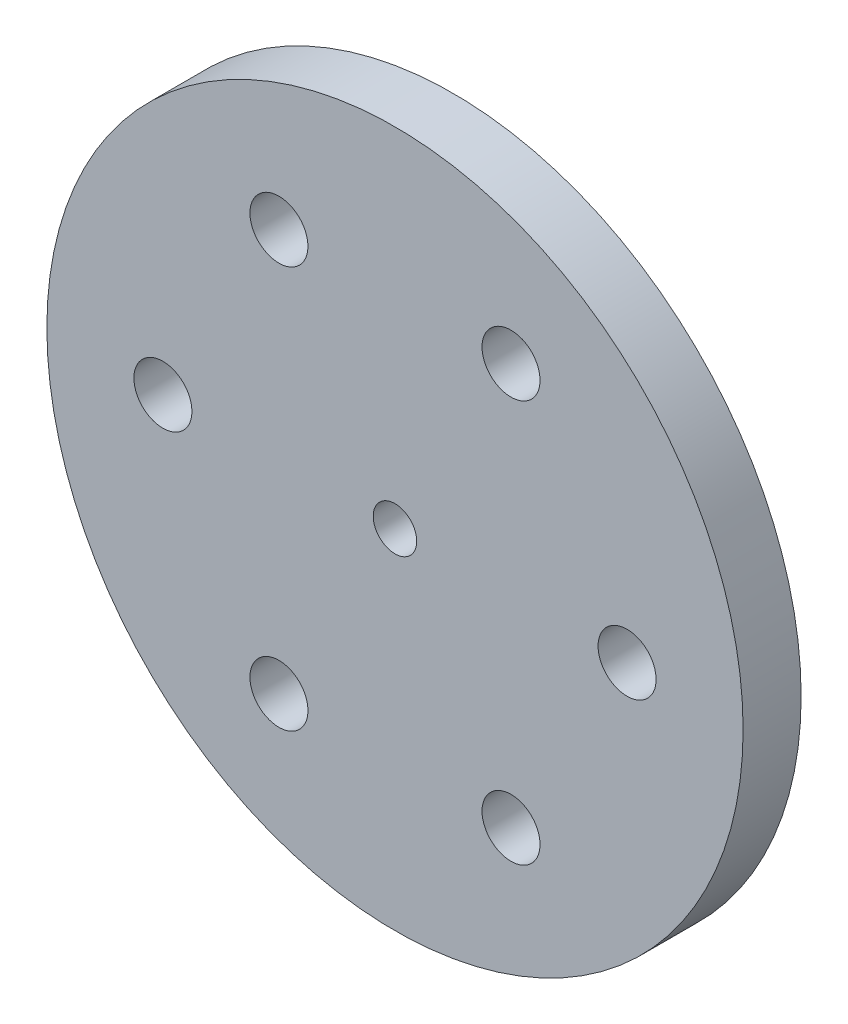
from build123d import *

# Parameters (mm, degrees)
SKETCH1_R           = 38.1
BOSS_EXTRUDE1_DEPTH = 6.35
SKETCH4_R           = 3.175
CUT_EXTRUDE2_DEPTH  = 55.254423783
SKETCH2_R           = 2.38125
CUT_EXTRUDE3_DEPTH  = 55.254423783


with BuildPart() as part:
    # Sketch1 → Boss-Extrude1 (new body)
    with BuildSketch(Plane.XY):
        Circle(SKETCH1_R)
    extrude(amount=BOSS_EXTRUDE1_DEPTH)

    # Sketch4 → Cut-Extrude2 (cut, through all)
    with BuildSketch(Plane(origin=(0, 0, 0), x_dir=(-1, 0, 0), z_dir=(0, 0, -1))):
        with Locations((-25.4, 0)):
            Circle(SKETCH4_R)
        with Locations((-12.7, 21.997045256)):
            Circle(SKETCH4_R)
        with Locations((12.7, 21.997045256)):
            Circle(SKETCH4_R)
        with Locations((25.4, 0)):
            Circle(SKETCH4_R)
        with Locations((12.7, -21.997045256)):
            Circle(SKETCH4_R)
        with Locations((-12.7, -21.997045256)):
            Circle(SKETCH4_R)
    extrude(amount=-CUT_EXTRUDE2_DEPTH, mode=Mode.SUBTRACT)

    # Sketch2 → Cut-Extrude3 (cut, through all)
    with BuildSketch(Plane.XY.offset(6.35)):
        Circle(SKETCH2_R)
    extrude(amount=-CUT_EXTRUDE3_DEPTH, mode=Mode.SUBTRACT)


solid = part.part
